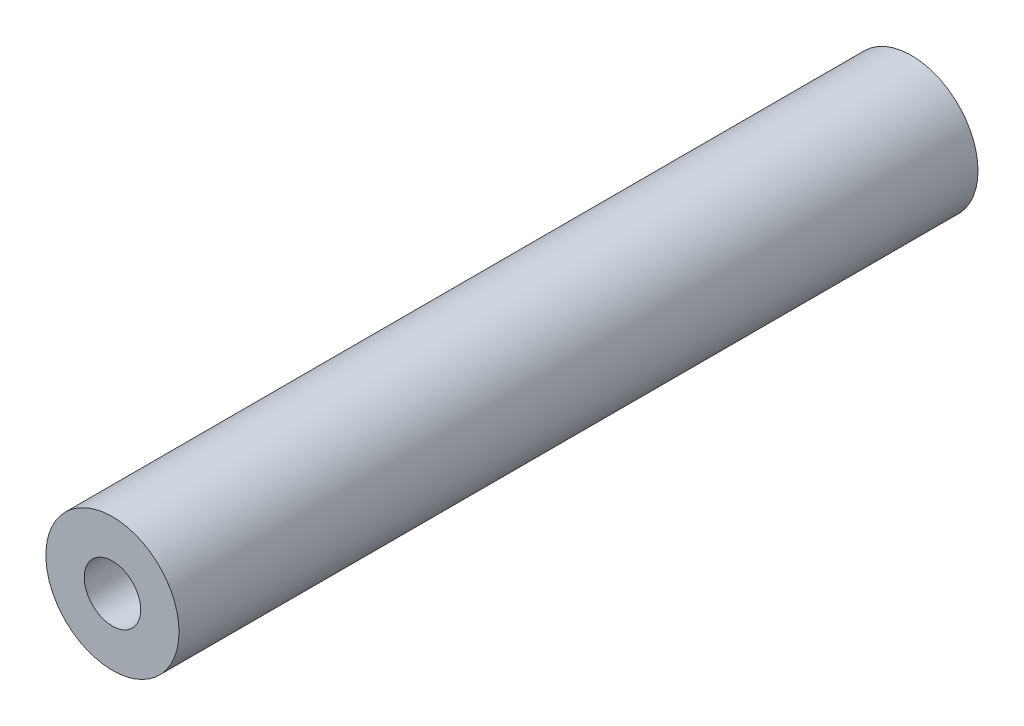
from build123d import *

# Parameters (mm, degrees)
SKETCH1_R                        = 4.7625
BOSS_EXTRUDE1_DEPTH              = 57.15
F_10_32_TAPPED_HOLE1_D           = 4.0386
F_10_32_TAPPED_HOLE1_ON_FACE_2_D = 4.0386


with BuildPart() as part:
    # Sketch1 → Boss-Extrude1 (new body)
    with BuildSketch(Plane.XY):
        Circle(SKETCH1_R)
    extrude(amount=BOSS_EXTRUDE1_DEPTH)

    # #10-32 Tapped Hole1 (through all)
    with Locations(Plane.XY.offset(57.15)):
        with Locations((0, 0)):
            Hole(F_10_32_TAPPED_HOLE1_D / 2)

    # #10-32 Tapped Hole1 on face 2 (through all)
    with Locations(Plane(origin=(0, 0, 0), x_dir=(-1, 0, 0), z_dir=(0, 0, -1))):
        with Locations((0, 0)):
            Hole(F_10_32_TAPPED_HOLE1_ON_FACE_2_D / 2)


solid = part.part
